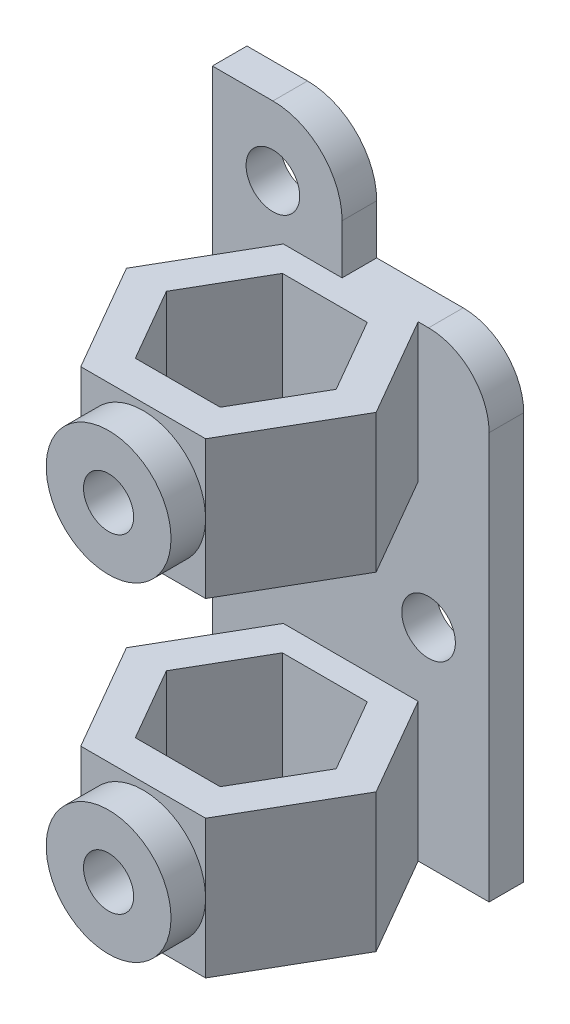
from build123d import *

# Parameters (mm, degrees)
SKETCH1_W           = 16
SKETCH1_H           = 33.8605711
SKETCH1_R           = 1.55
BOSS_EXTRUDE1_DEPTH = 2
BOSS_EXTRUDE2_DEPTH = 8
BOSS_EXTRUDE3_START = 11
BOSS_EXTRUDE3_DEPTH = 8
CUT_EXTRUDE1_REACH  = 25.38
SKETCH4_R           = 1.45
CUT_EXTRUDE2_REACH  = 24.24
FILLET1_R           = 3.5
BOSS_EXTRUDE4_START = 2
SKETCH6_R           = 3.608439182
SKETCH6_R_2         = 1.45
BOSS_EXTRUDE4_DEPTH = 2


with BuildPart() as part:
    # Sketch1 → Boss-Extrude1 (new body)
    with BuildSketch(Plane.XY):
        Rectangle(SKETCH1_W, SKETCH1_H)
        with Locations((-4.5, 12.93028555)):
            Circle(SKETCH1_R, mode=Mode.SUBTRACT)
        with Locations((4.5, -4.93028555)):
            Circle(SKETCH1_R, mode=Mode.SUBTRACT)
    extrude(amount=BOSS_EXTRUDE1_DEPTH)

    # Sketch2 → Boss-Extrude2 (add)
    with BuildSketch(Plane.XZ.offset(16.93028555)):
        Polygon((-3.608439182, 14), (-7.216878365, 7.75), (-3.897114317, 2), (3.897114317, 2), (7.216878365, 7.75), (3.608439182, 14), align=None)
        Polygon((-2.453738644, 3.5), (2.453738644, 3.5), (4.907477288, 7.75), (2.453738644, 12), (-2.453738644, 12), (-4.907477288, 7.75), align=None, mode=Mode.SUBTRACT)
    extrude(amount=-BOSS_EXTRUDE2_DEPTH)

    # Sketch3 → Boss-Extrude3 (add)
    with BuildSketch(Plane(origin=(0, -8.93028555, 0), x_dir=(1, 0, 0), z_dir=(0, 1, 0)).offset(BOSS_EXTRUDE3_START)):
        Polygon((-3.608439182, -14), (3.608439182, -14), (7.216878365, -7.75), (3.897114317, -2), (-3.897114317, -2), (-7.216878365, -7.75), align=None)
        Polygon((-4.907477288, -7.75), (-2.453738644, -12), (2.453738644, -12), (4.907477288, -7.75), (2.453738644, -3.5), (-2.453738644, -3.5), align=None, mode=Mode.SUBTRACT)
    extrude(amount=BOSS_EXTRUDE3_DEPTH)

    # Sketch4 → Cut-Extrude1 (cut, up to next)
    with BuildSketch(Plane.XY.offset(14), mode=Mode.PRIVATE) as cut_extrude1_sk1:
        with Locations((0, -12.93028555)):
            Circle(SKETCH4_R)
    cut_extrude1_tool1 = extrude(cut_extrude1_sk1.sketch, amount=-CUT_EXTRUDE1_REACH, mode=Mode.PRIVATE) & part.part
    # Sketch4 → Cut-Extrude1 (cut, up to next)
    with BuildSketch(Plane.XY.offset(14), mode=Mode.PRIVATE) as cut_extrude1_sk2:
        with Locations((0, 6.06971445)):
            Circle(SKETCH4_R)
    cut_extrude1_tool2 = extrude(cut_extrude1_sk2.sketch, amount=-CUT_EXTRUDE1_REACH, mode=Mode.PRIVATE) & part.part
    add(cut_extrude1_tool1.solids().sort_by_distance((0, -12.930286, 14))[0], mode=Mode.SUBTRACT)
    add(cut_extrude1_tool2.solids().sort_by_distance((0, 6.069714, 14))[0], mode=Mode.SUBTRACT)

    # Sketch5 → Cut-Extrude2 (cut, up to next)
    with BuildSketch(Plane.XY.offset(2), mode=Mode.PRIVATE) as cut_extrude2_sk1:
        with BuildLine():
            Line((-0.5, 12.93028555), (-0.5, 10.06971445))
            Line((-0.5, 10.06971445), (8, 10.06971445))
            Line((8, 10.06971445), (8, 16.93028555))
            Line((8, 16.93028555), (-4.5, 16.93028555))
            ThreePointArc((-4.5, 16.93028555), (-1.671572875, 15.758712674), (-0.5, 12.93028555))
        make_face()
    cut_extrude2_tool1 = extrude(cut_extrude2_sk1.sketch, amount=-CUT_EXTRUDE2_REACH, mode=Mode.PRIVATE) & part.part
    add(cut_extrude2_tool1.solids().sort_by_distance((3.463989, 13.641064, 2))[0], mode=Mode.SUBTRACT)

    # Fillet1
    fillet1_edges = [part.edges().sort_by_distance(p)[0] for p in [
        (8, 10.06971445, 1),
    ]]
    fillet(fillet1_edges, radius=FILLET1_R)

    # Sketch6 → Boss-Extrude4 (add)
    # profile 1 of 2: a face of its own
    with BuildSketch(Plane.XY.offset(14).offset(BOSS_EXTRUDE4_START)):
        with Locations((0, 6.06971445)):
            Circle(SKETCH6_R)
        with Locations((0, 6.06971445)):
            Circle(SKETCH6_R_2, mode=Mode.SUBTRACT)
    # profile 2 of 2: a face of its own
    with BuildSketch(Plane.XY.offset(14).offset(BOSS_EXTRUDE4_START)):
        with Locations((0, -12.93028555)):
            Circle(SKETCH6_R)
        with Locations((0, -12.93028555)):
            Circle(SKETCH6_R_2, mode=Mode.SUBTRACT)
    extrude(amount=-BOSS_EXTRUDE4_DEPTH)


solid = part.part
